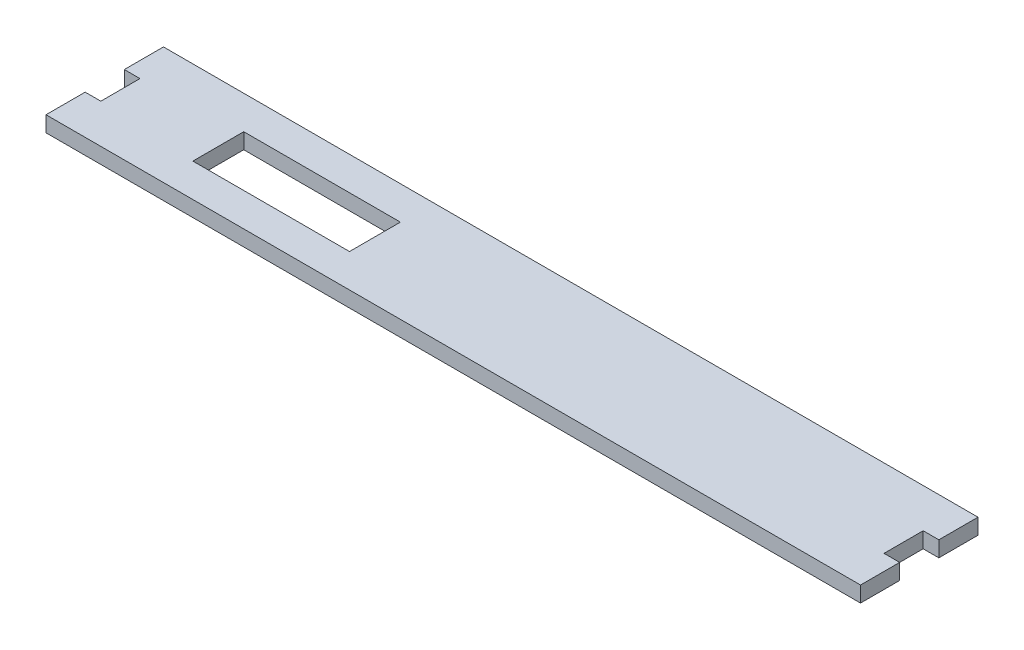
from build123d import *

# Parameters (mm, degrees)
SKETCH1_W           = 200
SKETCH1_H           = 30
SKETCH1_W_2         = 40
SKETCH1_H_2         = 13
SKETCH1_W_3         = 4
SKETCH1_H_3         = 10
BOSS_EXTRUDE1_DEPTH = 4


with BuildPart() as part:
    # Sketch1 → Boss-Extrude1 (new body)
    # profile 1 of 5: a face of its own
    with BuildSketch(Plane(origin=(0, 0, 0), x_dir=(1, 0, 0), z_dir=(0, 1, 0))):
        with Locations((100, 15)):
            Rectangle(SKETCH1_W, SKETCH1_H)
        with Locations((45, 15)):
            Rectangle(SKETCH1_W_2, SKETCH1_H_2, mode=Mode.SUBTRACT)
    # profile 2 of 5: a face of its own
    with BuildSketch(Plane(origin=(0, 0, 0), x_dir=(1, 0, 0), z_dir=(0, 1, 0))):
        with Locations((-2, 5)):
            Rectangle(SKETCH1_W_3, SKETCH1_H_3)
    # profile 3 of 5: a face of its own
    with BuildSketch(Plane(origin=(0, 0, 0), x_dir=(1, 0, 0), z_dir=(0, 1, 0))):
        with Locations((-2, 25)):
            Rectangle(SKETCH1_W_3, SKETCH1_H_3)
    # profile 4 of 5: a face of its own
    with BuildSketch(Plane(origin=(0, 0, 0), x_dir=(1, 0, 0), z_dir=(0, 1, 0))):
        with Locations((202, 25)):
            Rectangle(SKETCH1_W_3, SKETCH1_H_3)
    # profile 5 of 5: a face of its own
    with BuildSketch(Plane(origin=(0, 0, 0), x_dir=(1, 0, 0), z_dir=(0, 1, 0))):
        with Locations((202, 5)):
            Rectangle(SKETCH1_W_3, SKETCH1_H_3)
    extrude(amount=BOSS_EXTRUDE1_DEPTH)


solid = part.part
